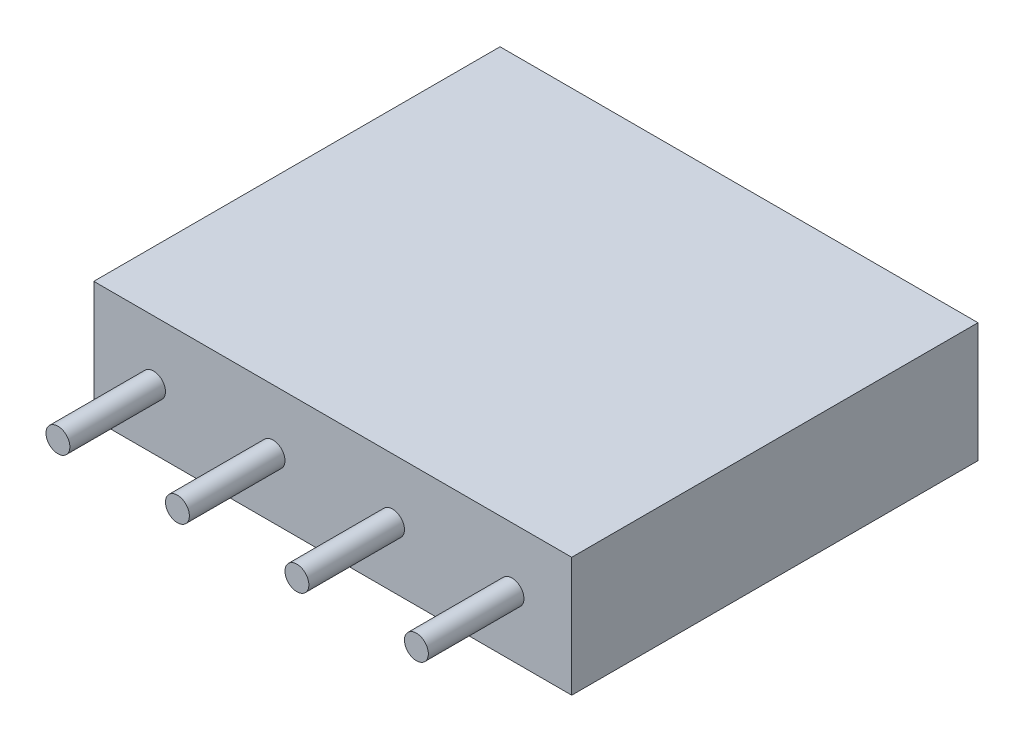
from build123d import *

# Parameters (mm, degrees)
ESQUISSE1_W                = 2.5
ESQUISSE1_H                = 2.5
BOSS_EXTRU_1_DEPTH         = 8.5
ESQUISSE2_R                = 0.25
BOSS_EXTRU_2_DEPTH         = 2
ESQUISSE3_R                = 0.25
ENL_V_MAT_EXTRU_2_DEPTH    = 4
R_P_TITION_LIN_AIRE1_COUNT = 4
R_P_TITION_LIN_AIRE1_PITCH = 2.5


with BuildPart() as part:
    # Esquisse1 → Boss.-Extru.1 (new body)
    with BuildSketch(Plane.XY):
        with Locations((-1.25, 1.25)):
            Rectangle(ESQUISSE1_W, ESQUISSE1_H)
    boss_extru_1 = extrude(amount=BOSS_EXTRU_1_DEPTH)

    # Esquisse2 → Boss.-Extru.2 (add)
    with BuildSketch(Plane.XY.offset(8.5)):
        with Locations((-1.25, 1.25)):
            Circle(ESQUISSE2_R)
    boss_extru_2 = extrude(amount=BOSS_EXTRU_2_DEPTH)

    # Esquisse3 → Enlèv. mat.-Extru.2 (cut)
    with BuildSketch(Plane(origin=(0, 0, 0), x_dir=(-1, 0, 0), z_dir=(0, 0, -1))):
        with Locations(Location((1.25, 1.25, 0), (0, 0, 180))):
            Circle(ESQUISSE3_R)
    enl_v_mat_extru_2 = extrude(amount=-ENL_V_MAT_EXTRU_2_DEPTH, mode=Mode.SUBTRACT)

    # Répétition linéaire1: Boss.-Extru.1, Boss.-Extru.2, Enlèv. mat.-Extru.2 ×4
    with Locations(*[(-i * R_P_TITION_LIN_AIRE1_PITCH, 0, 0) for i in range(1, R_P_TITION_LIN_AIRE1_COUNT)]):
        add(boss_extru_1)
        add(boss_extru_2)
        add(enl_v_mat_extru_2, mode=Mode.SUBTRACT)


solid = part.part
